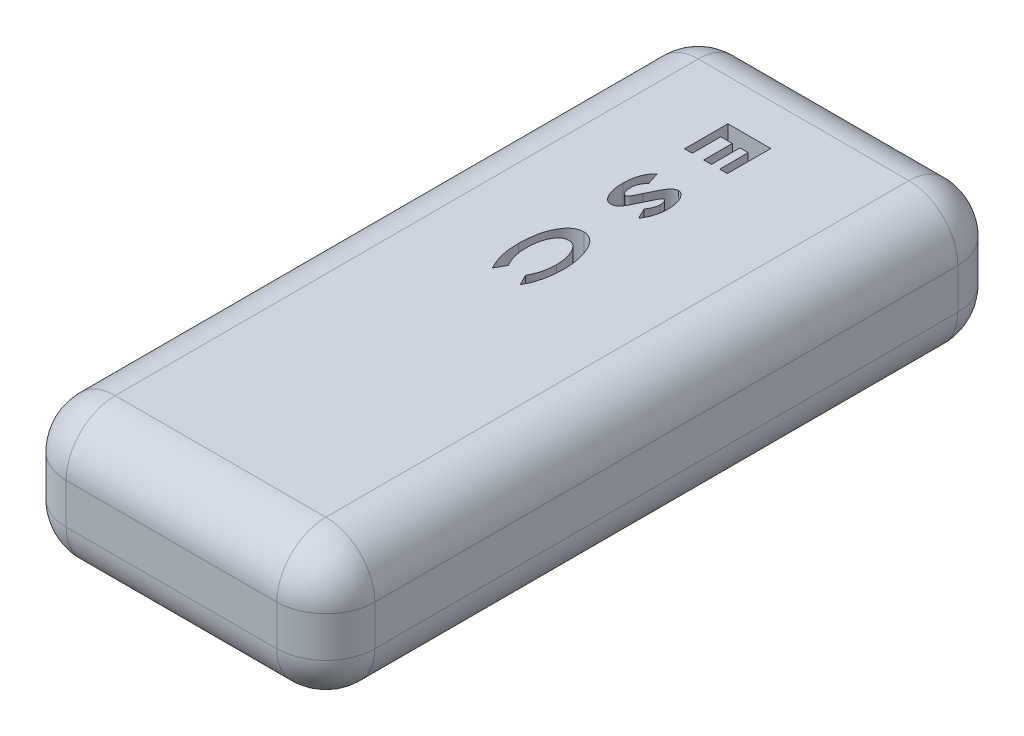
from build123d import *

# Parameters (mm, degrees)
SKETCH1_W           = 25.2
SKETCH1_H           = 55.6
BOSS_EXTRUDE1_DEPTH = 5.65
FILLET1_R           = 4
CUT_EXTRUDE1_DEPTH  = 5


with BuildPart() as part:
    # Sketch1 → Boss-Extrude1 (new, symmetric)
    with BuildSketch(Plane(origin=(0, 0, 0), x_dir=(1, 0, 0), z_dir=(0, 1, 0))):
        with Locations((-44.1, -2.495)):
            Rectangle(SKETCH1_W, SKETCH1_H)
    extrude(amount=BOSS_EXTRUDE1_DEPTH, both=True)

    # Fillet1
    fillet1_edges = [part.edges().sort_by_distance(p)[0] for p in [
        (-31.5, 5.65, 2.495),
        (-44.1, 5.65, -25.305),
        (-56.7, 5.65, 2.495),
        (-44.1, -5.65, -25.305),
        (-31.5, -5.65, 2.495),
        (-44.1, -5.65, 30.295),
        (-56.7, -5.65, 2.495),
        (-56.7, 0, -25.305),
        (-31.5, 0, -25.305),
        (-31.5, 0, 30.295),
        (-56.7, 0, 30.295),
        (-44.1, 5.65, 30.295),
    ]]
    fillet(fillet1_edges, radius=FILLET1_R)

    # Sketch2 → Cut-Extrude1 (cut)
    with BuildSketch(Plane(origin=(0, 5.65, 0), x_dir=(1, 0, 0), z_dir=(0, 1, 0))):
        Polygon((-43.404456835, 17.937329916), (-43.404456835, 14.392458121), (-44.032661964, 14.392458121), (-44.032661964, 16.725791455), (-44.705738887, 16.725791455), (-44.705738887, 14.392458121), (-45.333944015, 14.392458121), (-45.333944015, 16.725791455), (-46.276251707, 16.725791455), (-46.276251707, 14.392458121), (-46.904456835, 14.392458121), (-46.904456835, 17.937329916), align=None)
        with BuildLine():
            Line((-43.872105073, 7.607842737), (-44.301892733, 8.496164051))
            add(Edge.make_bspline(
                [(-44.301892733, 8.496164051), (-44.273227652, 8.534769153), (-44.216902025, 8.610626489), (-44.144696017, 8.729303549), (-44.08189752, 8.847625637), (-44.031578153, 8.966902221), (-43.991644691, 9.086841138), (-43.963919341, 9.207281116), (-43.946097049, 9.328331293), (-43.943978971, 9.409197232), (-43.942918374, 9.449689692)],
                knots=[0, 0, 0, 0, 1.111743256, 2.184526813, 3.209822052, 4.207903708, 5.175535075, 6.130212618, 7.063730773, 8, 8, 8, 8], degree=3))
            add(Edge.make_bspline(
                [(-43.942918374, 9.449689692), (-43.94361936, 9.487121623), (-43.944964936, 9.558974016), (-43.957996299, 9.661284873), (-43.980492871, 9.753020578), (-44.010482589, 9.832710957), (-44.046010073, 9.898045994), (-44.083708572, 9.947263567), (-44.125919458, 9.980085506), (-44.157506757, 9.984156225), (-44.172185201, 9.986047865)],
                knots=[0, 0, 0, 0, 1.437473698, 2.759299924, 3.952550345, 5.057999315, 6.022444791, 6.795013843, 7.440049578, 8, 8, 8, 8], degree=3))
            add(Edge.make_bspline(
                [(-44.172185201, 9.986047865), (-44.186867338, 9.98450644), (-44.21724111, 9.981317605), (-44.26161881, 9.960000436), (-44.302973265, 9.924373593), (-44.326946276, 9.894196521), (-44.33975331, 9.878075109)],
                knots=[0, 0, 0, 0, 0.852754848, 1.764142504, 2.805544136, 4, 4, 4, 4], degree=3))
            add(Edge.make_bspline(
                [(-44.33975331, 9.878075109), (-44.349983714, 9.862762094), (-44.3740034, 9.826809087), (-44.410445725, 9.761296241), (-44.456145635, 9.67841876), (-44.50843854, 9.576216958), (-44.568746867, 9.455973756), (-44.635606874, 9.316699966), (-44.711873129, 9.159898378), (-44.763863438, 9.048493113), (-44.791275746, 8.989753795)],
                knots=[0, 0, 0, 0, 0.44310876, 1.040362937, 1.803114438, 2.721421765, 3.803161782, 5.04096565, 6.439825429, 8, 8, 8, 8], degree=3))
            add(Edge.make_bspline(
                [(-44.791275746, 8.989753795), (-44.816773413, 8.934843691), (-44.865170196, 8.830619552), (-44.933458815, 8.682609063), (-44.995533402, 8.552252714), (-45.049257503, 8.438432859), (-45.096200625, 8.342005607), (-45.135385884, 8.26238478), (-45.167507902, 8.200023886), (-45.186896286, 8.164275278), (-45.1951219, 8.149108763)],
                knots=[0, 0, 0, 0, 1.557763454, 2.956770138, 4.194130677, 5.272746071, 6.19523143, 6.953612827, 7.556065307, 8, 8, 8, 8], degree=3))
            add(Edge.make_bspline(
                [(-45.1951219, 8.149108763), (-45.212011681, 8.119560296), (-45.244835483, 8.062135457), (-45.295470112, 7.98015702), (-45.344811889, 7.904144991), (-45.394723184, 7.835769569), (-45.443176754, 7.77344913), (-45.491261178, 7.71783337), (-45.539867173, 7.669738174), (-45.601211148, 7.613889071), (-45.680989791, 7.557963539), (-45.782415273, 7.508963336), (-45.888710142, 7.479039296), (-45.961497592, 7.4751652), (-45.997906355, 7.473227352)],
                knots=[0, 0, 0, 0, 1.11063655, 2.158424242, 3.1441953, 4.067186395, 4.920079633, 5.720077158, 6.464323847, 7.150286136, 8.426182732, 9.626990715, 10.813005087, 12, 12, 12, 12], degree=3))
            add(Edge.make_bspline(
                [(-45.997906355, 7.473227352), (-46.033370212, 7.474725236), (-46.103642721, 7.477693331), (-46.20615875, 7.505280991), (-46.303873526, 7.548120853), (-46.396067156, 7.609294655), (-46.483618955, 7.686785117), (-46.566331561, 7.781358171), (-46.643408583, 7.893581686), (-46.715500691, 8.021022558), (-46.780864333, 8.162263275), (-46.83842554, 8.314753226), (-46.886670654, 8.477889714), (-46.925508545, 8.651316416), (-46.956292452, 8.834821213), (-46.978568739, 9.028565749), (-46.992077698, 9.232848712), (-46.993481544, 9.372545083), (-46.994200425, 9.444080718)],
                knots=[0, 0, 0, 0, 0.703862664, 1.394721247, 2.095817628, 2.817552283, 3.584706939, 4.414372484, 5.308954249, 6.287024993, 7.322309666, 8.400232073, 9.524933161, 10.701794518, 11.931694134, 13.222772334, 14.577838903, 16, 16, 16, 16], degree=3))
            add(Edge.make_bspline(
                [(-46.994200425, 9.444080718), (-46.993679849, 9.500414963), (-46.992655381, 9.611278112), (-46.984038029, 9.774750428), (-46.970179403, 9.932628198), (-46.950604728, 10.084910247), (-46.92546577, 10.231606359), (-46.894552141, 10.372904607), (-46.858352842, 10.508695446), (-46.816216048, 10.639138588), (-46.76765399, 10.76432832), (-46.712921905, 10.885132221), (-46.651963747, 11.001552436), (-46.584683753, 11.113506661), (-46.510055605, 11.219841557), (-46.429873701, 11.322174611), (-46.342955725, 11.419811468), (-46.280358604, 11.480964032), (-46.248907957, 11.511688891)],
                knots=[0, 0, 0, 0, 1.194254911, 2.350237565, 3.469447841, 4.553538255, 5.604327029, 6.623810579, 7.618959621, 8.582588153, 9.528474942, 10.46422435, 11.392823643, 12.313084282, 13.231248423, 14.145137991, 15.068062428, 16, 16, 16, 16], degree=3))
            Line((-46.248907957, 11.511688891), (-45.917277348, 10.48805107))
            add(Edge.make_bspline(
                [(-45.917277348, 10.48805107), (-45.953071284, 10.449416674), (-46.023384621, 10.373523557), (-46.114609598, 10.250700137), (-46.192346072, 10.124125141), (-46.25599862, 9.992919029), (-46.305257722, 9.857077619), (-46.340287959, 9.716834109), (-46.362069168, 9.572367996), (-46.364678163, 9.47453885), (-46.365995297, 9.425150429)],
                knots=[0, 0, 0, 0, 1.066818731, 2.095650682, 3.094877062, 4.07363992, 5.046112855, 6.018031898, 6.999416043, 8, 8, 8, 8], degree=3))
            add(Edge.make_bspline(
                [(-46.365995297, 9.425150429), (-46.364938297, 9.374827351), (-46.362909457, 9.278235636), (-46.343216916, 9.13952756), (-46.313765366, 9.012647426), (-46.27595182, 8.917190164), (-46.241928703, 8.849181648), (-46.215464126, 8.805749401), (-46.188006628, 8.768666909), (-46.159465464, 8.738269901), (-46.129618222, 8.714745681), (-46.099147969, 8.697173751), (-46.067009567, 8.687025179), (-46.045179581, 8.685514317), (-46.034364688, 8.684765814)],
                knots=[0, 0, 0, 0, 2.075737642, 3.984236815, 5.771665312, 7.43936092, 8.20724503, 8.908699603, 9.535699088, 10.108813302, 10.624047538, 11.099065136, 11.553663749, 12, 12, 12, 12], degree=3))
            add(Edge.make_bspline(
                [(-46.034364688, 8.684765814), (-46.014144943, 8.686768628), (-45.971566637, 8.69098611), (-45.910590768, 8.724968379), (-45.850534003, 8.776168677), (-45.802077153, 8.834253609), (-45.761824394, 8.894088974), (-45.726282793, 8.952478507), (-45.68612921, 9.022636239), (-45.643352743, 9.105425194), (-45.595282232, 9.199649912), (-45.543616029, 9.306000672), (-45.488360542, 9.424671948), (-45.450498666, 9.507852919), (-45.430698823, 9.551352352)],
                knots=[0, 0, 0, 0, 0.662878688, 1.39587574, 2.24810084, 3.258010336, 3.87268769, 4.622298683, 5.508014481, 6.533718633, 7.690003413, 8.990873577, 10.426379345, 12, 12, 12, 12], degree=3))
            add(Edge.make_bspline(
                [(-45.430698823, 9.551352352), (-45.411618506, 9.593691632), (-45.374236288, 9.676642886), (-45.317955918, 9.797744176), (-45.264111469, 9.91360592), (-45.211755765, 10.023568105), (-45.160258938, 10.127303296), (-45.111351998, 10.225666234), (-45.063727753, 10.318254299), (-45.017284868, 10.404982989), (-44.973553878, 10.486460113), (-44.930435781, 10.561397868), (-44.889943257, 10.631055631), (-44.850748497, 10.694931635), (-44.812768745, 10.752908555), (-44.777447969, 10.805760107), (-44.742813577, 10.851937284), (-44.700677103, 10.90569621), (-44.647575426, 10.963599159), (-44.584628476, 11.026260078), (-44.520936126, 11.078683563), (-44.457540795, 11.122498274), (-44.393454105, 11.155338128), (-44.32993724, 11.179891721), (-44.26609289, 11.194488684), (-44.22343669, 11.196561062), (-44.202333438, 11.197586327)],
                knots=[0, 0, 0, 0, 1.564549007, 3.06526953, 4.498912689, 5.868873056, 7.168207176, 8.400619812, 9.56973607, 10.675745051, 11.715089482, 12.684853108, 13.588260275, 14.429556811, 15.209201813, 15.923315657, 16.570532871, 17.153391699, 18.223795354, 19.214868062, 20.143351609, 20.999403733, 21.805822904, 22.56332663, 23.289236268, 24, 24, 24, 24], degree=3))
            add(Edge.make_bspline(
                [(-44.202333438, 11.197586327), (-44.172246773, 11.196200784), (-44.112274632, 11.193438964), (-44.024608022, 11.167875143), (-43.940076123, 11.128363), (-43.859699865, 11.071698135), (-43.782719159, 10.999736338), (-43.709315647, 10.912119282), (-43.639094264, 10.808923264), (-43.573688282, 10.691296951), (-43.513156846, 10.56249538), (-43.459846293, 10.425015945), (-43.415250911, 10.280099647), (-43.377848051, 10.128244705), (-43.349300212, 9.968748692), (-43.329189651, 9.801844663), (-43.317190821, 9.627484008), (-43.315550401, 9.508836675), (-43.314713246, 9.448287448)],
                knots=[0, 0, 0, 0, 0.67637246, 1.348222014, 2.040632354, 2.770840753, 3.553184029, 4.408621639, 5.340289886, 6.360973649, 7.437278062, 8.544029208, 9.679704066, 10.850623889, 12.065060304, 13.327339486, 14.636062658, 16, 16, 16, 16], degree=3))
            add(Edge.make_bspline(
                [(-43.314713246, 9.448287448), (-43.316215181, 9.369707732), (-43.319189465, 9.214096315), (-43.342291157, 8.983843975), (-43.379237777, 8.759131765), (-43.423182362, 8.575705839), (-43.46705897, 8.430106246), (-43.50664351, 8.319081239), (-43.552184052, 8.2059571), (-43.603491032, 8.090244305), (-43.661912276, 7.972936771), (-43.725887414, 7.852723473), (-43.795575756, 7.730154038), (-43.846334387, 7.64903017), (-43.872105073, 7.607842737)],
                knots=[0, 0, 0, 0, 1.44895716, 2.869369924, 4.263127406, 5.6461743, 6.34427153, 7.066769811, 7.819107395, 8.5928208, 9.400460439, 10.235345418, 11.104066468, 12, 12, 12, 12], degree=3))
        make_face()
        with BuildLine():
            Line((-44.01162831, -1.913952135), (-44.451932797, -1.038952135))
            add(Edge.make_bspline(
                [(-44.451932797, -1.038952135), (-44.411176567, -0.963985803), (-44.32973085, -0.814175904), (-44.225908949, -0.57989099), (-44.139620974, -0.338120361), (-44.066438753, -0.090290244), (-44.011604753, 0.165058112), (-43.971575405, 0.427004937), (-43.947096595, 0.696089232), (-43.944321401, 0.877863826), (-43.942918374, 0.969761807)],
                knots=[0, 0, 0, 0, 0.976836263, 1.952072838, 2.930678178, 3.914779111, 4.908988058, 5.918807745, 6.947832234, 8, 8, 8, 8], degree=3))
            add(Edge.make_bspline(
                [(-43.942918374, 0.969761807), (-43.944022623, 1.046678486), (-43.94618998, 1.197646121), (-43.962412035, 1.419555766), (-43.989669055, 1.632061533), (-44.027291802, 1.835627199), (-44.076384842, 2.029715072), (-44.135566988, 2.214828084), (-44.207142135, 2.389958174), (-44.274195975, 2.529127911), (-44.334091341, 2.633395636), (-44.378188093, 2.707419946), (-44.425701142, 2.775100338), (-44.472906602, 2.838629623), (-44.522596166, 2.896224835), (-44.572545442, 2.949733348), (-44.624750399, 2.99726794), (-44.677384798, 3.040488316), (-44.731558533, 3.07837719), (-44.78684608, 3.111721845), (-44.844210805, 3.138784854), (-44.902223033, 3.162479812), (-44.962018346, 3.179623183), (-45.022629461, 3.192701752), (-45.084660391, 3.199456531), (-45.126398645, 3.200770099), (-45.147445618, 3.20143248)],
                knots=[0, 0, 0, 0, 1.998877112, 3.923281123, 5.778830326, 7.564543425, 9.299881437, 10.978652471, 12.610713729, 14.213384978, 14.988600364, 15.735482546, 16.451523719, 17.136654804, 17.791501502, 18.427369721, 19.03778097, 19.624965669, 20.196195344, 20.754524357, 21.300560343, 21.843071729, 22.381213459, 22.914880635, 23.452816666, 24, 24, 24, 24], degree=3))
            add(Edge.make_bspline(
                [(-45.147445618, 3.20143248), (-45.176712503, 3.200700975), (-45.234623896, 3.199253519), (-45.320189893, 3.185322858), (-45.403244545, 3.163039738), (-45.483458303, 3.131073643), (-45.561286012, 3.090816388), (-45.636532207, 3.041291073), (-45.709616611, 2.982955649), (-45.779392667, 2.915490586), (-45.846155154, 2.840219346), (-45.909108937, 2.75727831), (-45.968655279, 2.667265889), (-46.025266138, 2.570200239), (-46.076541248, 2.464844705), (-46.124993623, 2.352550796), (-46.169818881, 2.232966122), (-46.211154221, 2.106752087), (-46.246922668, 1.974569279), (-46.279657502, 1.838667685), (-46.306028653, 1.698908591), (-46.327555732, 1.555505168), (-46.34549917, 1.408734642), (-46.35676612, 1.258053416), (-46.365223696, 1.104006177), (-46.365736276, 0.99992238), (-46.365995297, 0.94732591)],
                knots=[0, 0, 0, 0, 0.749017488, 1.482106641, 2.213875219, 2.947428453, 3.688947406, 4.454240527, 5.250638559, 6.080324456, 6.93673807, 7.82497804, 8.744624723, 9.699342274, 10.700436652, 11.743330843, 12.830539396, 13.969971078, 15.143217264, 16.336550412, 17.549135835, 18.784143752, 20.049921298, 21.33479964, 22.653199306, 24, 24, 24, 24], degree=3))
            add(Edge.make_bspline(
                [(-46.365995297, 0.94732591), (-46.364641668, 0.858478835), (-46.361991297, 0.684518476), (-46.341456924, 0.429298293), (-46.307294022, 0.185799982), (-46.267227744, -0.010341687), (-46.227172493, -0.164063256), (-46.189896996, -0.280610098), (-46.148882335, -0.400524514), (-46.101827283, -0.523041129), (-46.04903144, -0.64839571), (-45.990077228, -0.776051145), (-45.926188154, -0.907049024), (-45.880341887, -0.994428058), (-45.856980874, -1.038952135)],
                knots=[0, 0, 0, 0, 1.541497127, 3.018212967, 4.439316312, 5.805636982, 6.489242487, 7.19465516, 7.928203462, 8.688090346, 9.471367754, 10.287907724, 11.127601611, 12, 12, 12, 12], degree=3))
            Line((-45.856980874, -1.038952135), (-46.326031355, -1.887309507))
            add(Edge.make_bspline(
                [(-46.326031355, -1.887309507), (-46.356510712, -1.827644963), (-46.416717045, -1.709788692), (-46.500047284, -1.532593597), (-46.575768036, -1.357496375), (-46.645214911, -1.185613585), (-46.707567392, -1.016042823), (-46.760906832, -0.848479063), (-46.809245946, -0.683934853), (-46.849315746, -0.520059902), (-46.88405123, -0.354755626), (-46.913146995, -0.184895202), (-46.93865356, -0.009606076), (-46.958580741, 0.171429771), (-46.974998152, 0.357950787), (-46.985778105, 0.550392242), (-46.993229667, 0.748381836), (-46.993874276, 0.882348082), (-46.994200425, 0.950130397)],
                knots=[0, 0, 0, 0, 1.090858625, 2.154789433, 3.187607735, 4.196682849, 5.172995152, 6.128506555, 7.059446741, 7.964845523, 8.874608044, 9.809266184, 10.770413712, 11.758373766, 12.774370719, 13.818809713, 14.896392703, 16, 16, 16, 16], degree=3))
            add(Edge.make_bspline(
                [(-46.994200425, 0.950130397), (-46.993819593, 1.012770127), (-46.993064839, 1.136913065), (-46.986350085, 1.320868596), (-46.976861343, 1.500662587), (-46.962841, 1.675771509), (-46.944651288, 1.846681435), (-46.922060386, 2.013080153), (-46.896545604, 2.175727569), (-46.86535561, 2.333634611), (-46.831333622, 2.487616172), (-46.792391752, 2.636867081), (-46.751034877, 2.782214124), (-46.703279207, 2.922595575), (-46.653406621, 3.059242332), (-46.598508704, 3.191334633), (-46.539488465, 3.318873048), (-46.477459239, 3.442106187), (-46.412063132, 3.5591296), (-46.343897365, 3.669205538), (-46.272843927, 3.771227212), (-46.201203015, 3.867106438), (-46.125895909, 3.95439004), (-46.047789838, 4.033365021), (-45.968704402, 4.106343565), (-45.886486892, 4.170777301), (-45.802248035, 4.227915669), (-45.71557904, 4.277032748), (-45.627003451, 4.319536696), (-45.535830182, 4.354060819), (-45.442038061, 4.379807503), (-45.346438032, 4.398639434), (-45.248516428, 4.411396807), (-45.182308593, 4.412442473), (-45.148847861, 4.412970942)],
                knots=[0, 0, 0, 0, 1.396860247, 2.76837614, 4.104600482, 5.411722946, 6.685428478, 7.937007861, 9.156288506, 10.356279676, 11.525893359, 12.672426772, 13.795683788, 14.894986445, 15.978359584, 17.039170401, 18.08388081, 19.111776416, 20.115106104, 21.072511062, 21.997770218, 22.886919655, 23.740532263, 24.56607828, 25.36296141, 26.138685412, 26.893250929, 27.630850388, 28.358196026, 29.082266538, 29.801764581, 30.524408129, 31.254251643, 32, 32, 32, 32], degree=3))
            add(Edge.make_bspline(
                [(-45.148847861, 4.412970942), (-45.105779657, 4.411538899), (-45.020099097, 4.408689969), (-44.893499641, 4.388417269), (-44.771298579, 4.352151133), (-44.651877374, 4.305136874), (-44.537297004, 4.241270999), (-44.425315647, 4.165934536), (-44.318380348, 4.074746655), (-44.214910593, 3.970996215), (-44.115345331, 3.854624776), (-44.02156955, 3.725387321), (-43.931565934, 3.585236846), (-43.847717387, 3.432438599), (-43.768314638, 3.267946909), (-43.694477887, 3.091284543), (-43.62500937, 2.902982712), (-43.560968191, 2.70414936), (-43.503270823, 2.497378147), (-43.452647599, 2.285269988), (-43.410084268, 2.069363508), (-43.374643367, 1.849602343), (-43.348605326, 1.625666985), (-43.32852606, 1.397983344), (-43.317489508, 1.16618554), (-43.315643897, 1.010437378), (-43.314713246, 0.93190123)],
                knots=[0, 0, 0, 0, 0.721738152, 1.435837178, 2.141160394, 2.854657658, 3.582048783, 4.334882803, 5.113195239, 5.93297674, 6.7885784, 7.676946564, 8.606981669, 9.578207257, 10.595986753, 11.666761074, 12.785768575, 13.958749614, 15.166583174, 16.382581243, 17.61235953, 18.853832993, 20.112096989, 21.389743113, 22.683775682, 24, 24, 24, 24], degree=3))
            add(Edge.make_bspline(
                [(-43.314713246, 0.93190123), (-43.31524135, 0.864817811), (-43.316292454, 0.731299412), (-43.32507908, 0.532107692), (-43.338695467, 0.334716744), (-43.35959298, 0.13936236), (-43.384159647, -0.054388497), (-43.416440138, -0.245921777), (-43.452217982, -0.436001155), (-43.495284523, -0.623132835), (-43.542397424, -0.806373636), (-43.595332316, -0.983683571), (-43.651397291, -1.155065014), (-43.71458253, -1.319263457), (-43.780510653, -1.477769731), (-43.852406277, -1.629436858), (-43.928412717, -1.774998667), (-43.984068595, -1.8679329), (-44.01162831, -1.913952135)],
                knots=[0, 0, 0, 0, 1.085999067, 2.161500663, 3.227382213, 4.288694212, 5.341813975, 6.388675703, 7.432737186, 8.472677087, 9.496824677, 10.495251065, 11.467989896, 12.415228697, 13.342797702, 14.246595466, 15.131747972, 16, 16, 16, 16], degree=3))
        make_face()
    extrude(amount=-CUT_EXTRUDE1_DEPTH, mode=Mode.SUBTRACT)


solid = part.part
